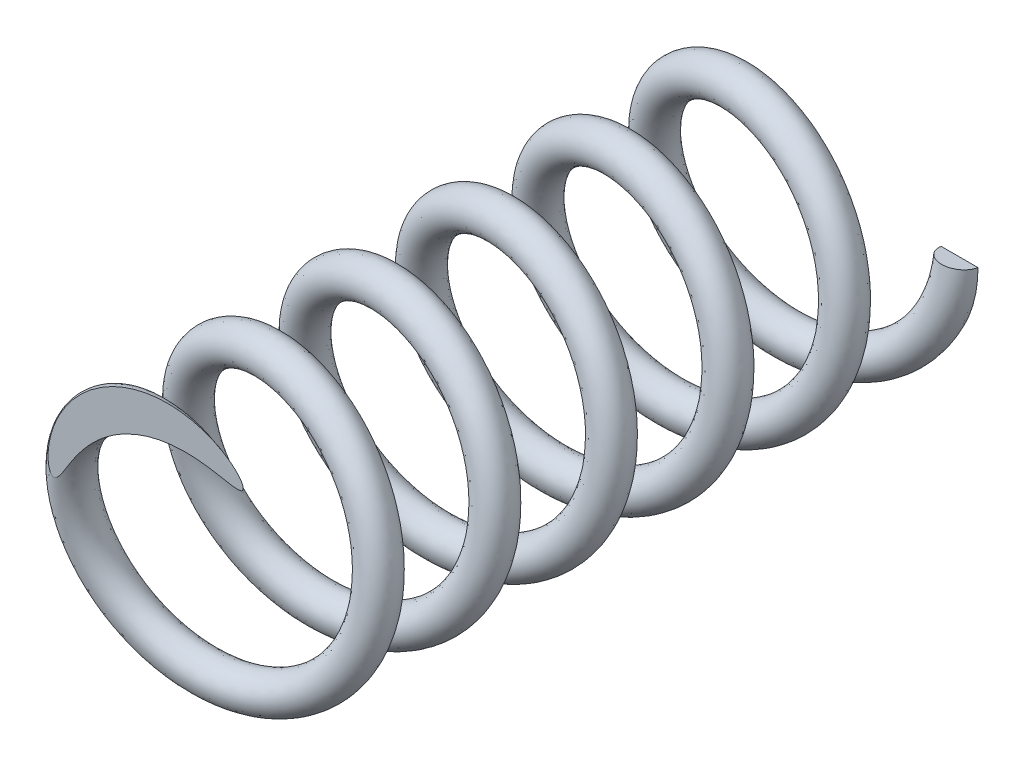
from build123d import *

# Parameters (mm, degrees)
SWEEP2_PITCH       = 19
SWEEP2_HEIGHT      = 133
SWEEP2_RADIUS      = 20
SKETCH83_R         = 3
CUT_EXTRUDE3_REACH = 141.803
SKETCH85_W         = 70
SKETCH85_H         = 70
CUT_EXTRUDE4_REACH = 117.635
SKETCH86_W         = 70
SKETCH86_H         = 70


with BuildPart() as part:
    # Sweep2: sweep along a helix
    with BuildLine() as sweep2_path:
        Helix(SWEEP2_PITCH, SWEEP2_HEIGHT, SWEEP2_RADIUS, center=(0, 0, 0), direction=(0, 0, 1), lefthand=True)
    # Sketch83 → Sweep2 (sweep)
    with BuildSketch(Plane(origin=(20, 0, 0), x_dir=(-1, 0, 0), z_dir=(-1.6328743068519001e-15, -0.9887620211788911, 0.14949804505154585))):
        Circle(SKETCH83_R)
    sweep(path=sweep2_path.line, is_frenet=True)

    # Sketch85 → Cut-Extrude3 (cut, up to next)
    with BuildSketch(Plane.XY, mode=Mode.PRIVATE) as cut_extrude3_sk1:
        Rectangle(SKETCH85_W, SKETCH85_H)
    cut_extrude3_tool1 = extrude(cut_extrude3_sk1.sketch, amount=-CUT_EXTRUDE3_REACH, mode=Mode.PRIVATE) & part.part
    add(cut_extrude3_tool1.solids().sort_by_distance((0, 0, 0))[0], mode=Mode.SUBTRACT)

    # Sketch86 → Cut-Extrude4 (cut, up to next)
    with BuildSketch(Plane(origin=(0, 0, 108), x_dir=(-1, 0, 0), z_dir=(0, 0, -1)), mode=Mode.PRIVATE) as cut_extrude4_sk1:
        Rectangle(SKETCH86_W, SKETCH86_H)
    cut_extrude4_tool1 = extrude(cut_extrude4_sk1.sketch, amount=-CUT_EXTRUDE4_REACH, mode=Mode.PRIVATE) & part.part
    add(cut_extrude4_tool1.solids().sort_by_distance((0, 0, 108))[0], mode=Mode.SUBTRACT)


solid = part.part
